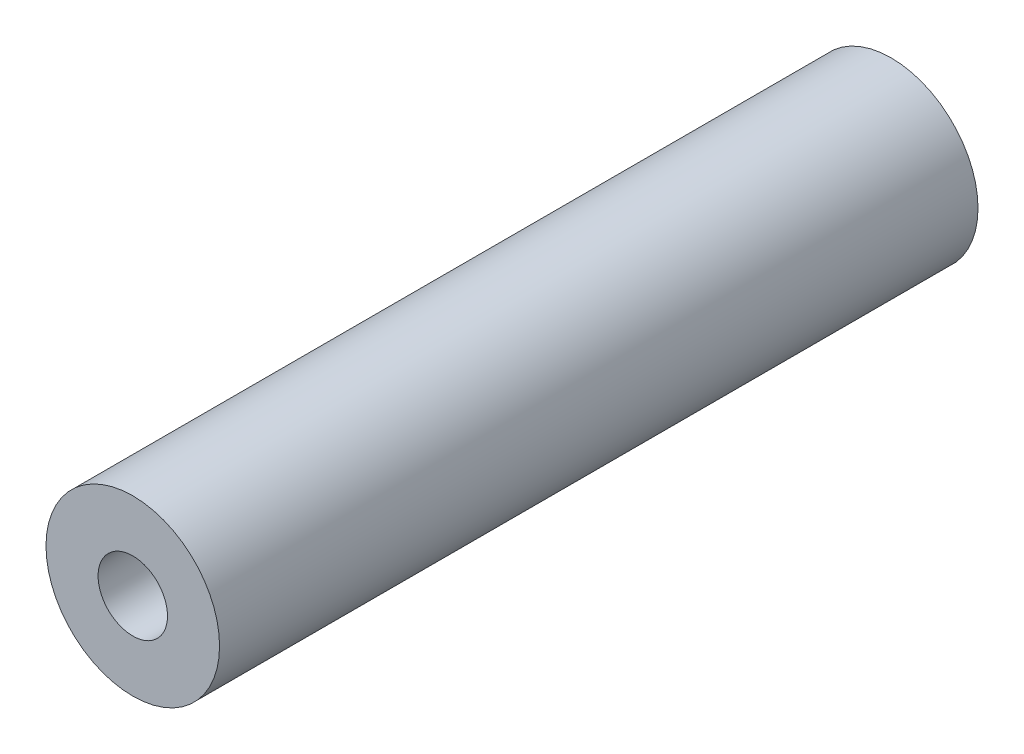
from build123d import *

# Parameters (mm, degrees)
SKETCH_1_R      = 5
SKETCH_1_R_2    = 2
EXTRUDE_1_DEPTH = 43.7


with BuildPart() as part:
    # 草图1 → 凸台-拉伸1 (new body)
    with BuildSketch(Plane.XY):
        Circle(SKETCH_1_R)
        Circle(SKETCH_1_R_2, mode=Mode.SUBTRACT)
    extrude(amount=EXTRUDE_1_DEPTH)


solid = part.part
